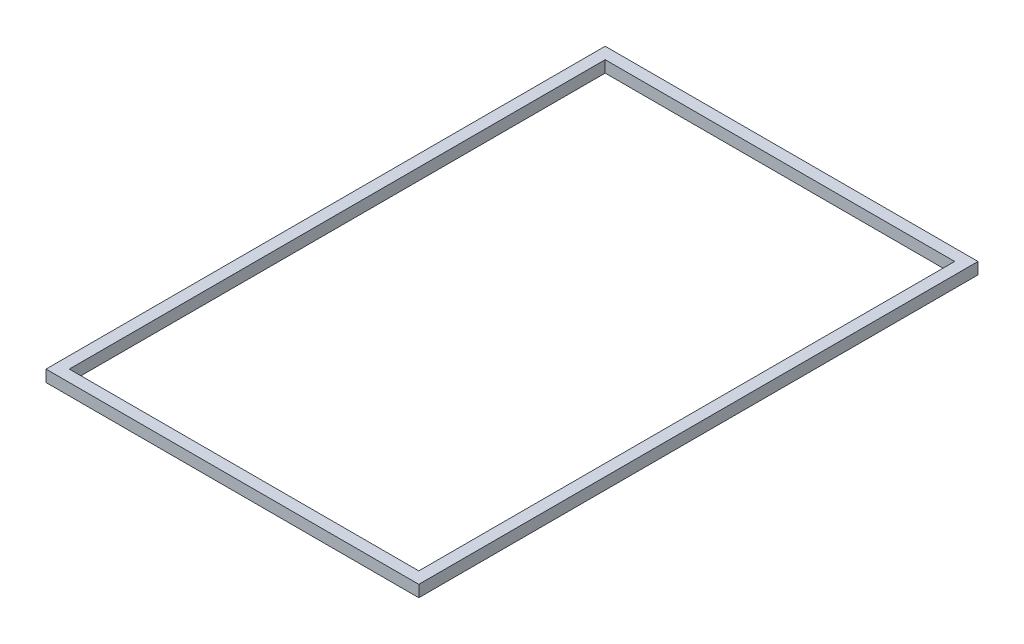
from build123d import *

# Parameters (mm, degrees)
SKETCH1_W           = 101.6
SKETCH1_H           = 152.4
SKETCH1_W_2         = 95.25
SKETCH1_H_2         = 146.05
BOSS_EXTRUDE1_DEPTH = 3.175


with BuildPart() as part:
    # Sketch1 → Boss-Extrude1 (new body)
    with BuildSketch(Plane(origin=(0, 0, 0), x_dir=(1, 0, 0), z_dir=(0, 1, 0))):
        with Locations((50.8, 76.2)):
            Rectangle(SKETCH1_W, SKETCH1_H)
        with Locations((50.8, 76.2)):
            Rectangle(SKETCH1_W_2, SKETCH1_H_2, mode=Mode.SUBTRACT)
    extrude(amount=BOSS_EXTRUDE1_DEPTH)


solid = part.part
